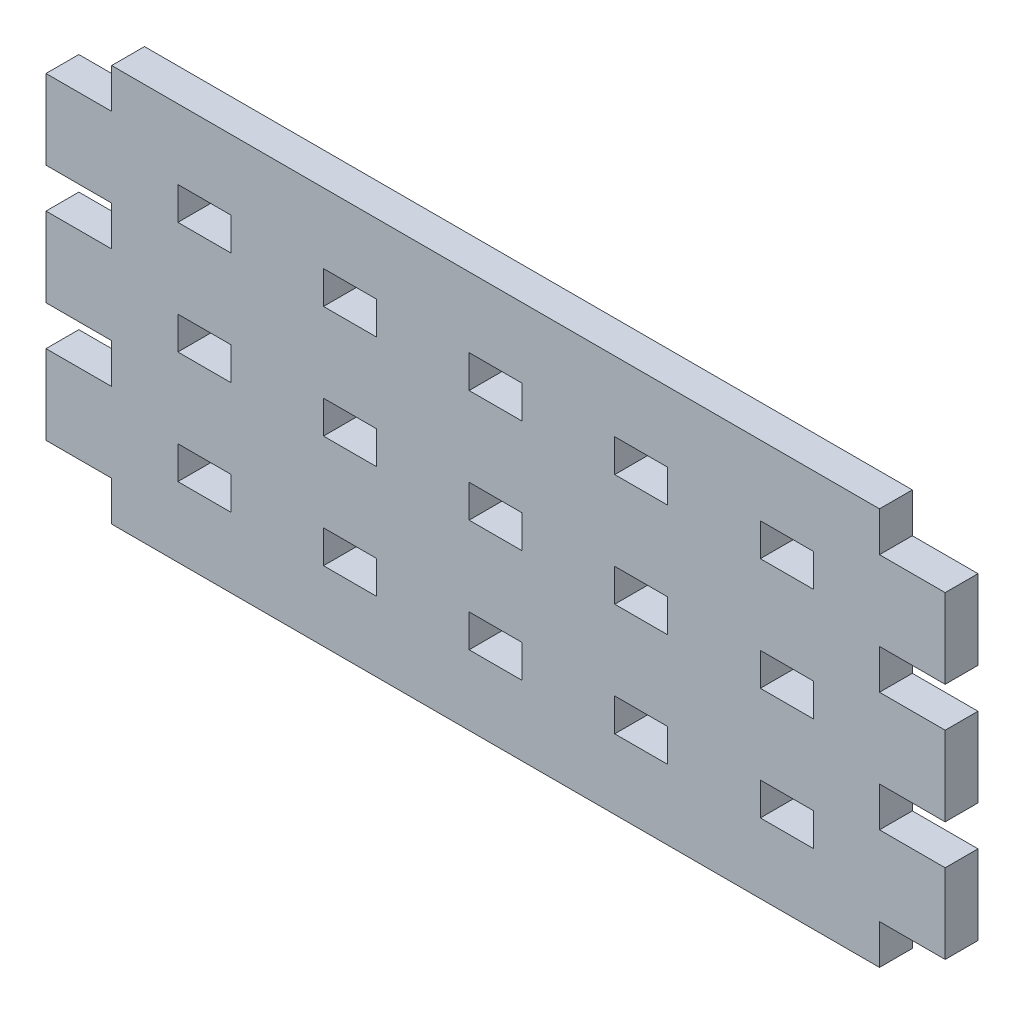
from build123d import *

# Parameters (mm, degrees)
MODEL_W             = 20
MODEL_H             = 12.4
BOSS_EXTRUDE1_DEPTH = 12.4


with BuildPart() as part:
    # Model → Boss-Extrude1 (new body)
    with BuildSketch(Plane.XY):
        Polygon((0, 135), (0, 150), (290, 150), (290, 135), (314.8, 135), (314.8, 105), (290, 105), (290, 90), (314.8, 90), (314.8, 60), (290, 60), (290, 45), (314.8, 45), (314.8, 15), (290, 15), (290, 0), (0, 0), (0, 15), (-24.8, 15), (-24.8, 45), (0, 45), (0, 60), (-24.8, 60), (-24.8, 90), (0, 90), (0, 105), (-24.8, 105), (-24.8, 135), align=None)
        with Locations((200, 117.4)):
            Rectangle(MODEL_W, MODEL_H, mode=Mode.SUBTRACT)
        with Locations((145, 117.4)):
            Rectangle(MODEL_W, MODEL_H, mode=Mode.SUBTRACT)
        with Locations((255, 117.4)):
            Rectangle(MODEL_W, MODEL_H, mode=Mode.SUBTRACT)
        with Locations((200, 75)):
            Rectangle(MODEL_W, MODEL_H, mode=Mode.SUBTRACT)
        with Locations((255, 75)):
            Rectangle(MODEL_W, MODEL_H, mode=Mode.SUBTRACT)
        with Locations((200, 32.6)):
            Rectangle(MODEL_W, MODEL_H, mode=Mode.SUBTRACT)
        with Locations((255, 32.6)):
            Rectangle(MODEL_W, MODEL_H, mode=Mode.SUBTRACT)
        with Locations((145, 75)):
            Rectangle(MODEL_W, MODEL_H, mode=Mode.SUBTRACT)
        with Locations((145, 32.6)):
            Rectangle(MODEL_W, MODEL_H, mode=Mode.SUBTRACT)
        with Locations((90, 117.4)):
            Rectangle(MODEL_W, MODEL_H, mode=Mode.SUBTRACT)
        with Locations((35, 117.4)):
            Rectangle(MODEL_W, MODEL_H, mode=Mode.SUBTRACT)
        with Locations((90, 75)):
            Rectangle(MODEL_W, MODEL_H, mode=Mode.SUBTRACT)
        with Locations((35, 75)):
            Rectangle(MODEL_W, MODEL_H, mode=Mode.SUBTRACT)
        with Locations((90, 32.6)):
            Rectangle(MODEL_W, MODEL_H, mode=Mode.SUBTRACT)
        with Locations((35, 32.6)):
            Rectangle(MODEL_W, MODEL_H, mode=Mode.SUBTRACT)
    extrude(amount=BOSS_EXTRUDE1_DEPTH)


solid = part.part
